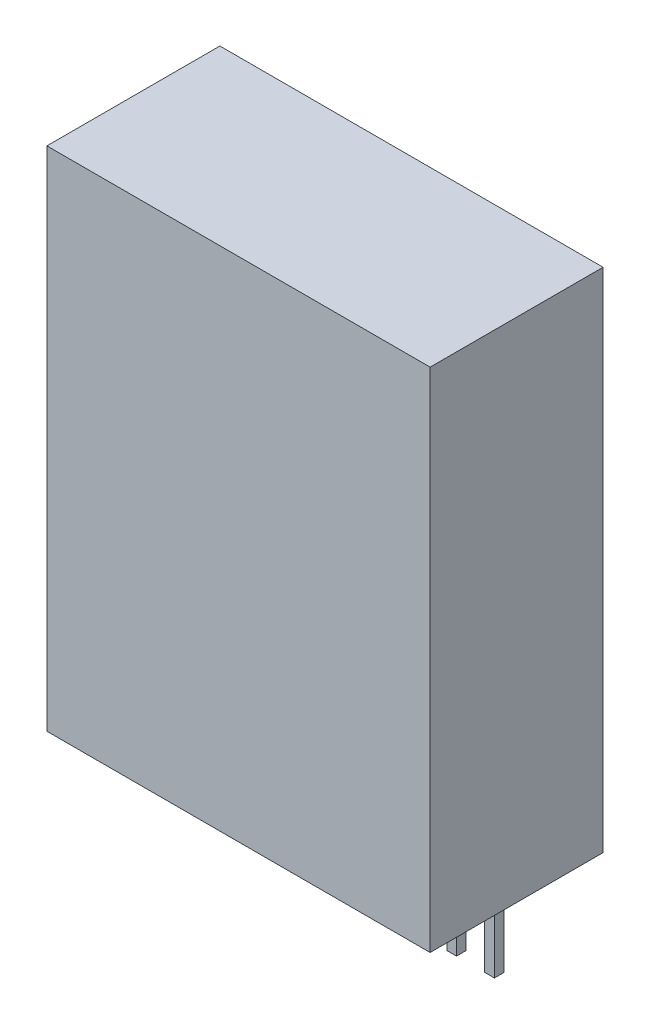
from build123d import *

# Parameters (mm, degrees)
ESQUISSE1_W                    = 25.7
ESQUISSE1_H                    = 34
BOSS_EXTRU_1_DEPTH             = 5.8
ESQUISSE2_W                    = 0.65
ESQUISSE2_H                    = 0.65
BOSS_EXTRU_2_DEPTH             = 6
R_P_TITION_LIN_AIRE1_COUNT     = 5
R_P_TITION_LIN_AIRE1_PITCH     = 2.54
R_P_TITION_LIN_AIRE1_COL_COUNT = 5
R_P_TITION_LIN_AIRE1_COL_PITCH = 2.54


with BuildPart() as part:
    # Esquisse1 → Boss.-Extru.1 (new, symmetric)
    with BuildSketch(Plane.XY):
        Rectangle(ESQUISSE1_W, ESQUISSE1_H)
    extrude(amount=BOSS_EXTRU_1_DEPTH, both=True)

    # Esquisse2 → Boss.-Extru.2 (add)
    with BuildSketch(Plane.XZ.offset(17)):
        with Locations((0, -1.2)):
            Rectangle(ESQUISSE2_W, ESQUISSE2_H)
    boss_extru_2 = extrude(amount=BOSS_EXTRU_2_DEPTH)

    # Répétition linéaire1: Boss.-Extru.2 ×5
    with Locations(*[(i * R_P_TITION_LIN_AIRE1_PITCH, 0, 0) for i in range(1, R_P_TITION_LIN_AIRE1_COUNT)]):
        add(boss_extru_2)

    # Répétition linéaire1 col: Boss.-Extru.2 ×5
    with Locations(*[(-i * R_P_TITION_LIN_AIRE1_COL_PITCH, 0, 0) for i in range(1, R_P_TITION_LIN_AIRE1_COL_COUNT)]):
        add(boss_extru_2)


solid = part.part
